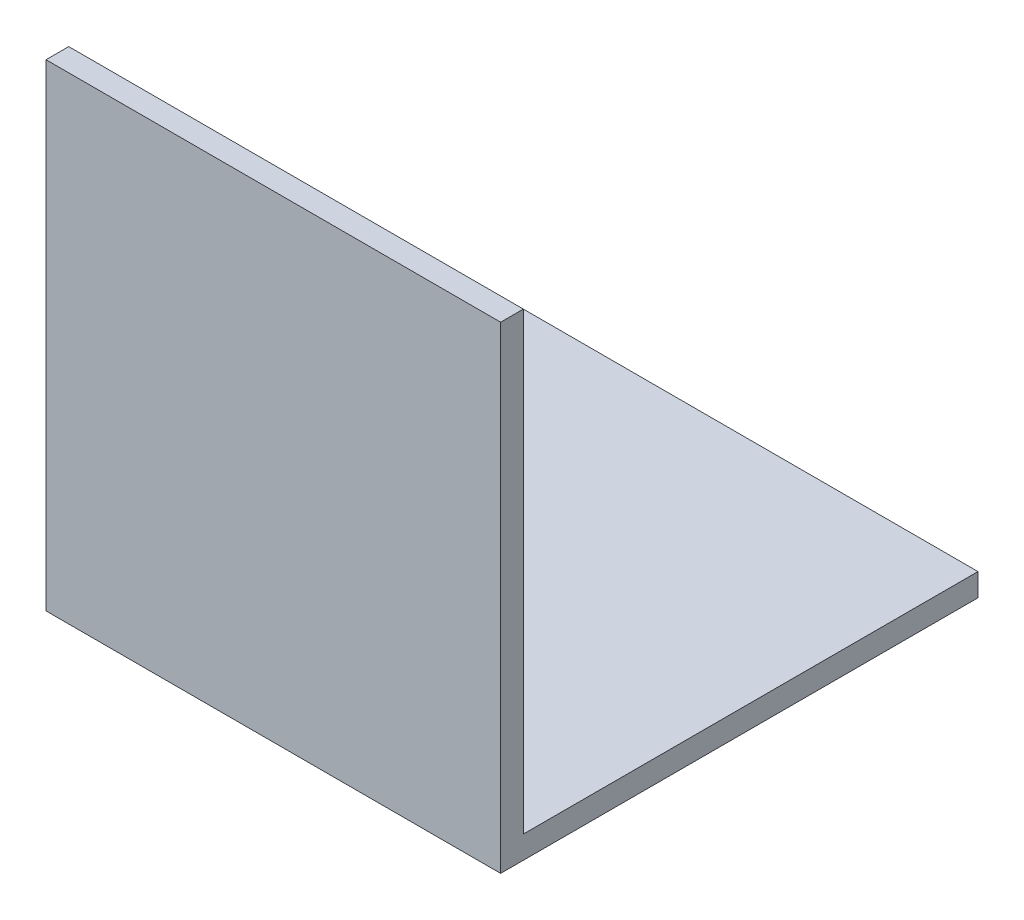
from build123d import *

# Parameters (mm, degrees)
SKETCH1_W           = 2000
SKETCH1_H           = 2000
BOSS_EXTRUDE1_DEPTH = 100
SKETCH2_W           = 2000
SKETCH2_H           = 2100
BOSS_EXTRUDE2_DEPTH = 100


with BuildPart() as part:
    # Sketch1 → Boss-Extrude1 (new body)
    with BuildSketch(Plane(origin=(0, 0, 0), x_dir=(1, 0, 0), z_dir=(0, 1, 0))):
        with Locations((0, -220.271966456)):
            Rectangle(SKETCH1_W, SKETCH1_H)
    extrude(amount=BOSS_EXTRUDE1_DEPTH)

    # Sketch2 → Boss-Extrude2 (add)
    with BuildSketch(Plane.XY.offset(1220.271966456)):
        with Locations((0, 1050)):
            Rectangle(SKETCH2_W, SKETCH2_H)
    extrude(amount=BOSS_EXTRUDE2_DEPTH)


solid = part.part
